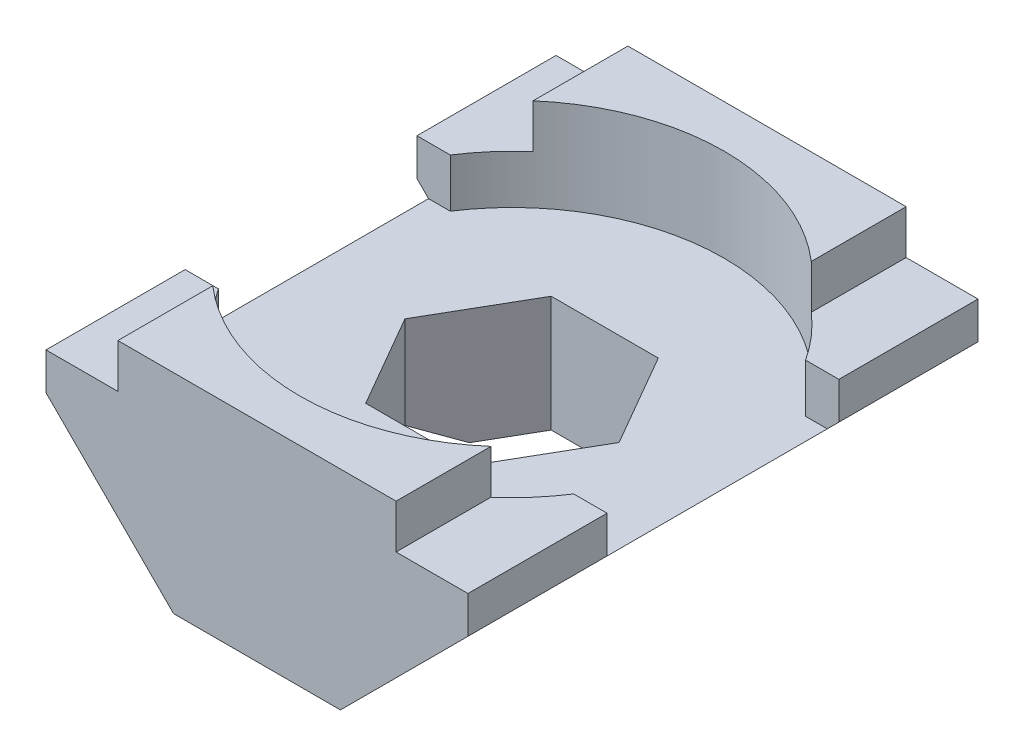
from build123d import *

# Parameters (mm, degrees)
BOSS_EXTRUDE1_DEPTH = 16
SKETCH2_R           = 4.575
CUT_EXTRUDE1_DEPTH  = 2
CUT_EXTRUDE2_DEPTH  = 18.867638344
SKETCH5_W           = 9.1
SKETCH5_H           = 5
CUT_EXTRUDE4_DEPTH  = 18.867638344
SKETCH6_W           = 9.1
SKETCH6_H           = 2.5
CUT_EXTRUDE5_DEPTH  = 19.255204737


with BuildPart() as part:
    # Sketch1 → Boss-Extrude1 (new body)
    with BuildSketch(Plane.XY):
        Polygon((0, 0), (0, 0.95), (6, 0.95), (6, 0), (7.55, 0), (7.55, -0.8), (4.8, -3.55), (1.2, -3.55), (-1.55, -0.8), (-1.55, 0), align=None)
    extrude(amount=BOSS_EXTRUDE1_DEPTH)

    # Sketch2 → Cut-Extrude1 (cut)
    with BuildSketch(Plane(origin=(0, 0.95, 0), x_dir=(1, 0, 0), z_dir=(0, 1, 0))):
        with Locations((3, -8)):
            Circle(SKETCH2_R)
    extrude(amount=-CUT_EXTRUDE1_DEPTH, mode=Mode.SUBTRACT)

    # Sketch3 → Cut-Extrude2 (cut, through all)
    with BuildSketch(Plane(origin=(0, -1.05, 0), x_dir=(1, 0, 0), z_dir=(0, 1, 0))):
        Polygon((5.309401077, -8), (4.154700538, -6), (1.845299462, -6), (0.690598923, -8), (1.845299462, -10), (4.154700538, -10), align=None)
    extrude(amount=-CUT_EXTRUDE2_DEPTH, mode=Mode.SUBTRACT)

    # Sketch5 → Cut-Extrude4 (cut, through all)
    with BuildSketch(Plane(origin=(0, -1.05, 0), x_dir=(1, 0, 0), z_dir=(0, 1, 0))):
        with Locations((3, -8)):
            Rectangle(SKETCH5_W, SKETCH5_H)
    extrude(amount=CUT_EXTRUDE4_DEPTH, mode=Mode.SUBTRACT)

    # Sketch6 → Cut-Extrude5 (cut, through all)
    with BuildSketch(Plane(origin=(0, 0.95, 0), x_dir=(1, 0, 0), z_dir=(0, 1, 0))):
        with Locations((3, -1.25)):
            Rectangle(SKETCH6_W, SKETCH6_H)
        with Locations((3, -14.75)):
            Rectangle(SKETCH6_W, SKETCH6_H)
    extrude(amount=-CUT_EXTRUDE5_DEPTH, mode=Mode.SUBTRACT)


solid = part.part
